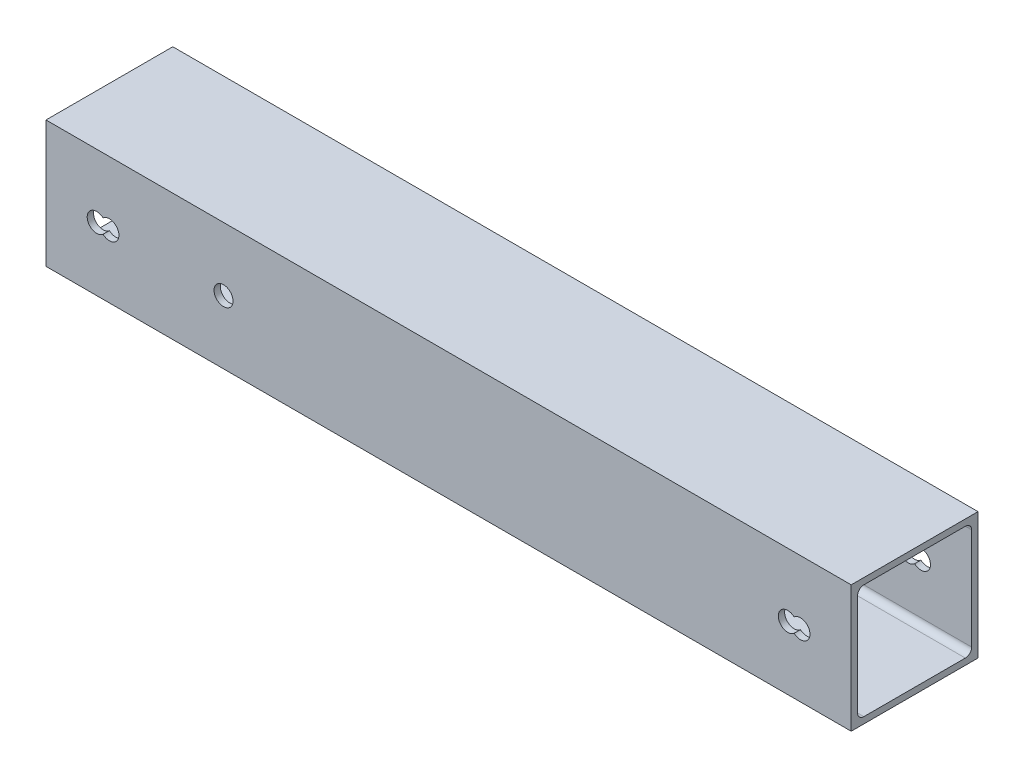
from build123d import *

# Parameters (mm, degrees)
SKETCH1_W           = 20
SKETCH1_H           = 20
BOSS_EXTRUDE1_DEPTH = 127
SKETCH5_R           = 1.5
CUT_EXTRUDE4_DEPTH  = 20
SKETCH2_R           = 1.5
CUT_EXTRUDE1_DEPTH  = 600
SKETCH3_R           = 1.5
CUT_EXTRUDE2_DEPTH  = 30


with BuildPart() as part:
    # Sketch1 → Boss-Extrude1 (new body)
    with BuildSketch(Plane(origin=(0, 0, 0), x_dir=(0, 0, -1), z_dir=(1, 0, 0))):
        Rectangle(SKETCH1_W, SKETCH1_H)
        with BuildLine():
            Line((-8, -9), (8, -9))
            ThreePointArc((8, -9), (8.707106781, -8.707106781), (9, -8))
            Line((9, -8), (9, 8))
            ThreePointArc((9, 8), (8.707106781, 8.707106781), (8, 9))
            Line((8, 9), (-8, 9))
            ThreePointArc((-8, 9), (-8.707106781, 8.707106781), (-9, 8))
            Line((-9, 8), (-9, -8))
            ThreePointArc((-9, -8), (-8.707106781, -8.707106781), (-8, -9))
        make_face(mode=Mode.SUBTRACT)
    extrude(amount=BOSS_EXTRUDE1_DEPTH)

    # Sketch5 → Cut-Extrude4 (cut)
    with BuildSketch(Plane.XY.offset(10)):
        with Locations((10, 0)):
            Circle(SKETCH5_R)
        with Locations((117, 0)):
            Circle(SKETCH5_R)
    extrude(amount=-CUT_EXTRUDE4_DEPTH, mode=Mode.SUBTRACT)

    # Sketch2 → Cut-Extrude1 (cut)
    with BuildSketch(Plane.XY.offset(10)):
        with Locations((8, 0)):
            Circle(SKETCH2_R)
        with Locations((28, 0)):
            Circle(SKETCH2_R)
    extrude(amount=-CUT_EXTRUDE1_DEPTH, mode=Mode.SUBTRACT)

    # Sketch3 → Cut-Extrude2 (cut)
    with BuildSketch(Plane.XY.offset(10)):
        with Locations((119, 0)):
            Circle(SKETCH3_R)
        with Locations((139, 0)):
            Circle(SKETCH3_R)
    extrude(amount=-CUT_EXTRUDE2_DEPTH, mode=Mode.SUBTRACT)


solid = part.part
